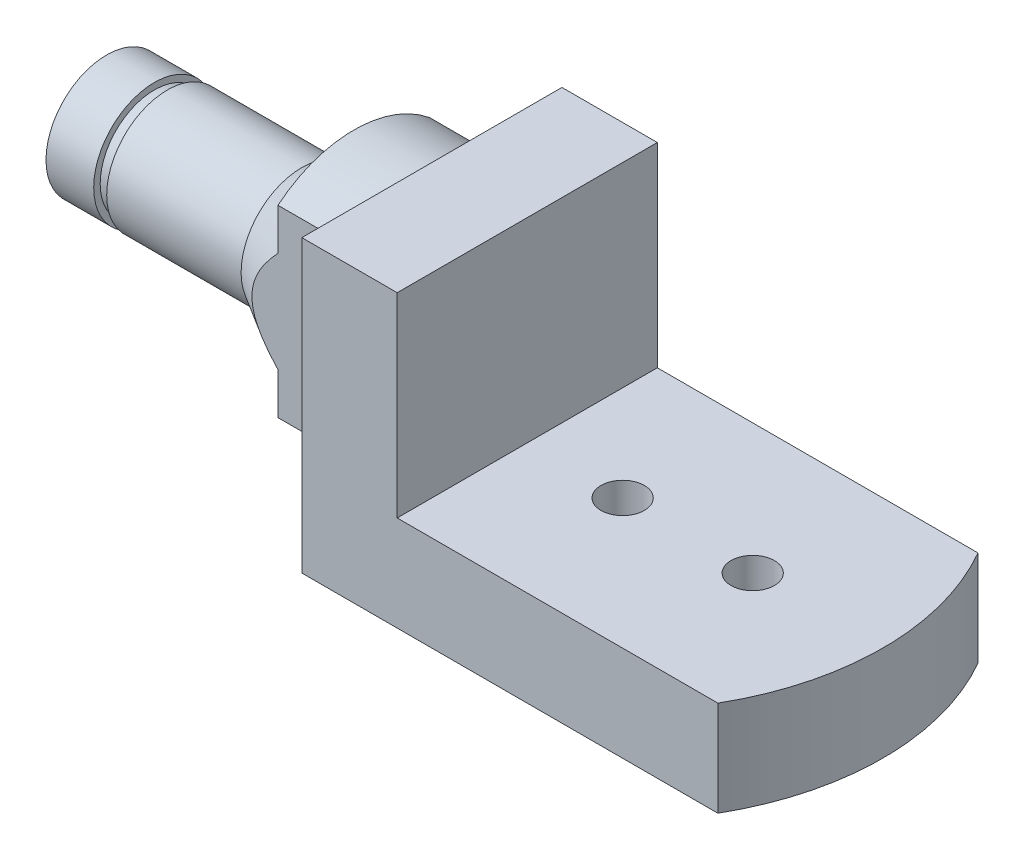
from build123d import *

# Parameters (mm, degrees)
SKETCH1_R           = 5
BOSS_EXTRUDE1_DEPTH = 22
BOSS_EXTRUDE2_DEPTH = 67
BOSS_EXTRUDE3_DEPTH = 18
SKETCH5_R           = 14
BOSS_EXTRUDE5_DEPTH = 31
SKETCH6_R           = 12.5
BOSS_EXTRUDE6_DEPTH = 3
SKETCH7_R           = 14
BOSS_EXTRUDE7_DEPTH = 11
SKETCH8_W           = 30
SKETCH8_H           = 67
CUT_EXTRUDE1_DEPTH  = 12.5
SKETCH9_R           = 5
CUT_EXTRUDE2_DEPTH  = 32.5


with BuildPart() as part:
    # Sketch1 → Boss-Extrude1 (new body)
    with BuildSketch(Plane(origin=(0, 0, 0), x_dir=(1, 0, 0), z_dir=(0, 1, 0))):
        with BuildLine():
            Line((-22, 0), (-22, -30))
            Line((-22, -30), (0, -30))
            Line((0, -30), (51.961524227, -30))
            ThreePointArc((51.961524227, -30), (60, 0), (51.961524227, 30))
            Line((51.961524227, 30), (0, 30))
            Line((0, 30), (-22, 30))
            Line((-22, 30), (-22, 0))
        make_face()
        with Locations((30, 0)):
            Circle(SKETCH1_R, mode=Mode.SUBTRACT)
    extrude(amount=BOSS_EXTRUDE1_DEPTH)

    # Sketch1<3> → Boss-Extrude2 (add)
    with BuildSketch(Plane(origin=(0, 0, 0), x_dir=(1, 0, 0), z_dir=(0, 1, 0))):
        Polygon((-44, -30), (-22, -30), (-22, 0), (-22, 30), (-44, 30), align=None)
    extrude(amount=BOSS_EXTRUDE2_DEPTH)

    # Sketch2 → Boss-Extrude3 (add)
    with BuildSketch(Plane.ZY.offset(44)):
        with BuildLine():
            ThreePointArc((0, 9.5), (19.445436483, 17.554563517), (27.5, 37))
            ThreePointArc((27.5, 37), (-19.445436483, 56.445436483), (0, 9.5))
        make_face()
    extrude(amount=BOSS_EXTRUDE3_DEPTH)

    # Sketch3 → Revolve2 (revolve)
    with BuildSketch(Plane.XY):
        Polygon((-62, 37), (-74, 37), (-74, 51), (-62, 58), align=None)
    revolve(axis=Axis((-62, 37, 0), (-1, 0, 0)))

    # Sketch5 → Boss-Extrude5 (add)
    with BuildSketch(Plane.ZY.offset(74)):
        with Locations((0, 37)):
            Circle(SKETCH5_R)
    extrude(amount=BOSS_EXTRUDE5_DEPTH)

    # Sketch6 → Boss-Extrude6 (add)
    with BuildSketch(Plane.ZY.offset(105)):
        with Locations((0, 37)):
            Circle(SKETCH6_R)
    extrude(amount=BOSS_EXTRUDE6_DEPTH)

    # Sketch7 → Boss-Extrude7 (add)
    with BuildSketch(Plane.ZY.offset(108)):
        with Locations((0, 37)):
            Circle(SKETCH7_R)
    extrude(amount=BOSS_EXTRUDE7_DEPTH)

    # Sketch8 → Cut-Extrude1 (cut)
    with BuildSketch(Plane.XY.offset(30)):
        with Locations((-59, 33.5)):
            Rectangle(SKETCH8_W, SKETCH8_H)
    cut_extrude1 = extrude(amount=-CUT_EXTRUDE1_DEPTH, mode=Mode.SUBTRACT)

    # Mirror1: Cut-Extrude1 across plane
    add(cut_extrude1.mirror(Plane.XY), mode=Mode.SUBTRACT)

    # Sketch9 → Cut-Extrude2 (cut)
    with BuildSketch(Plane(origin=(0, 22, 0), x_dir=(1, 0, 0), z_dir=(0, 1, 0))):
        Circle(SKETCH9_R)
    extrude(amount=-CUT_EXTRUDE2_DEPTH, mode=Mode.SUBTRACT)


solid = part.part
